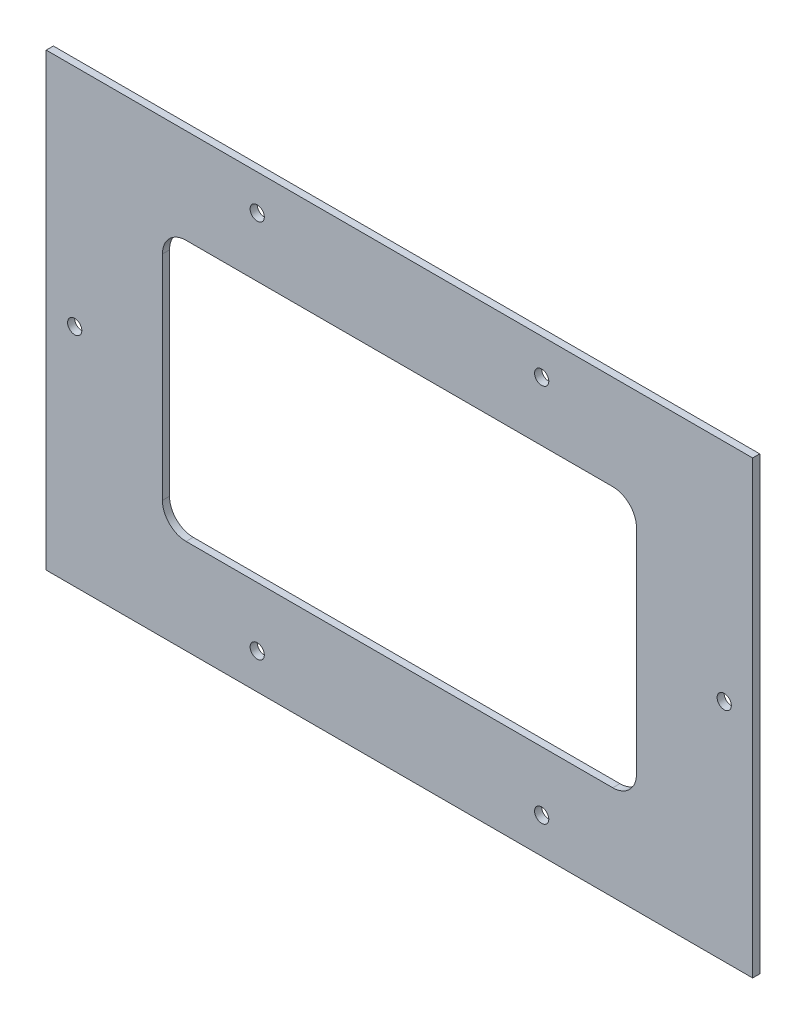
from build123d import *

# Parameters (mm, degrees)
ESQUISSE1_W             = 149
ESQUISSE1_H             = 165
ESQUISSE1_W_2           = 100
ESQUISSE1_H_2           = 55
BOSS_EXTRU_1_DEPTH      = 1.5
CONG_1_R                = 5
ESQUISSE2_R             = 1.5
ENL_V_MAT_EXTRU_1_DEPTH = 182.045574373
ESQUISSE3_R             = 1.5
ESQUISSE3_W             = 149
ESQUISSE3_H             = 10
ESQUISSE3_H_2           = 60
ENL_V_MAT_EXTRU_2_DEPTH = 182.045574373


with BuildPart() as part:
    # Esquisse1 → Boss.-Extru.1 (new body)
    with BuildSketch(Plane.XY):
        with Locations((0, 82.5)):
            Rectangle(ESQUISSE1_W, ESQUISSE1_H)
        with Locations((0, 107.5)):
            Rectangle(ESQUISSE1_W_2, ESQUISSE1_H_2, mode=Mode.SUBTRACT)
    extrude(amount=BOSS_EXTRU_1_DEPTH)

    # Congé1
    cong_1_edges = [part.edges().sort_by_distance(p)[0] for p in [
        (-50, 135, 0.75),
        (-50, 80, 0.75),
        (50, 80, 0.75),
        (50, 135, 0.75),
    ]]
    fillet(cong_1_edges, radius=CONG_1_R)

    # Esquisse2 → Enlèv. mat.-Extru.1 (cut, through all)
    with BuildSketch(Plane.XY.offset(1.5)):
        with Locations((-30, 147.5)):
            Circle(ESQUISSE2_R)
        with Locations(Location((-30, 67.5, 0), (0, 0, 180))):
            Circle(ESQUISSE2_R)
        with Locations((30, 67.5)):
            Circle(ESQUISSE2_R)
        with Locations(Location((30, 147.5, 0), (0, 0, 180))):
            Circle(ESQUISSE2_R)
        with Locations((-55, 160)):
            Circle(ESQUISSE2_R)
        with Locations(Location((-55, 5, 0), (0, 0, 180))):
            Circle(ESQUISSE2_R)
        with Locations((55, 5)):
            Circle(ESQUISSE2_R)
        with Locations(Location((55, 160, 0), (0, 0, 180))):
            Circle(ESQUISSE2_R)
    extrude(amount=-ENL_V_MAT_EXTRU_1_DEPTH, mode=Mode.SUBTRACT)

    # Esquisse3 → Enlèv. mat.-Extru.2 (cut, through all)
    with BuildSketch(Plane.XY.offset(1.5)):
        with Locations((-68.5, 107.5)):
            Circle(ESQUISSE3_R)
        with Locations(Location((68.5, 107.5, 0), (0, 0, 180))):
            Circle(ESQUISSE3_R)
        with Locations((0, 160)):
            Rectangle(ESQUISSE3_W, ESQUISSE3_H)
        with Locations((0, 30)):
            Rectangle(ESQUISSE3_W, ESQUISSE3_H_2)
    extrude(amount=-ENL_V_MAT_EXTRU_2_DEPTH, mode=Mode.SUBTRACT)


solid = part.part
